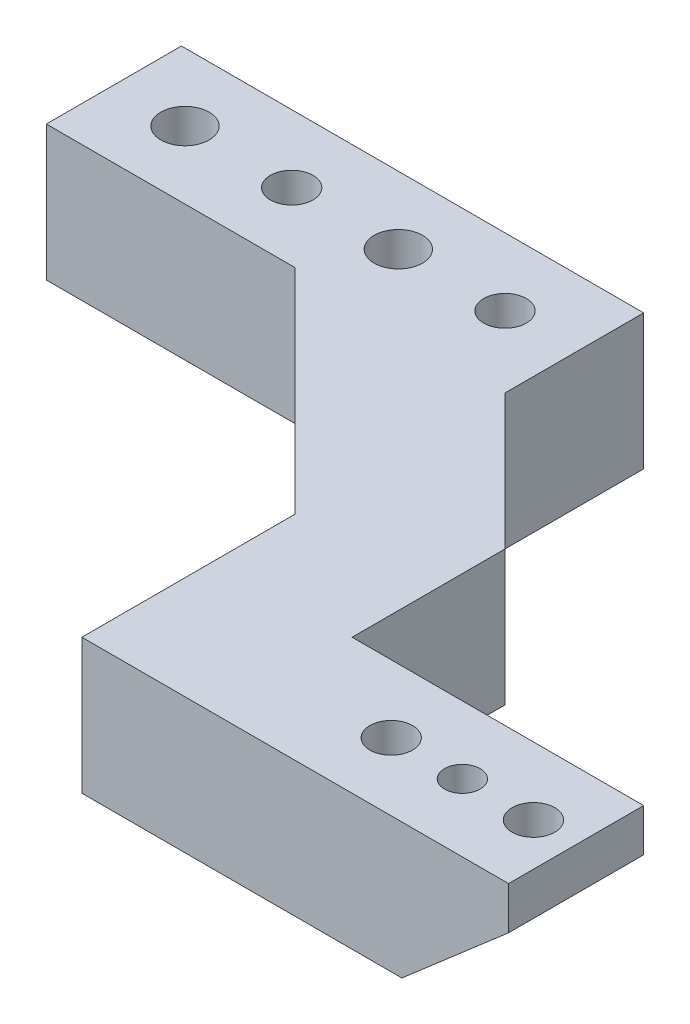
from build123d import *

# Parameters (mm, degrees)
SKETCH_1_W               = 65
SKETCH_1_H               = 19
EXTRUDE_1_DEPTH          = 19
HOLE_WIZARD_M8_2_D       = 6.8
MM_2_D                   = 6
MM_2_DEPTH               = 20
MM_2_TIP                 = 1.802581857
SKETCH_6_W               = 79
SKETCH_6_H               = 19
EXTRUDE_2_DEPTH          = 60
MM_3_D                   = 6
HOLE_WIZARD_M6_1_D       = 5
CHAMFER_2_SIZE           = 30
CUT_EXTRUDE_1_DEPTH      = 118.249733475
CUT_EXTRUDE_2_DEPTH      = 124.118845024
CUT_EXTRUDE_2_DEPTH_BACK = 124.118845024


with BuildPart() as part:
    # 草图1 → 凸台-拉伸1 (new body)
    with BuildSketch(Plane(origin=(0, 0, 0), x_dir=(1, 0, 0), z_dir=(0, 1, 0))):
        Rectangle(SKETCH_1_W, SKETCH_1_H)
    extrude(amount=EXTRUDE_1_DEPTH)

    # M8 螺纹孔2 (through all)
    with Locations(Plane(origin=(0, 19, 0), x_dir=(1, 0, 0), z_dir=(0, 1, 0))):
        with Locations((-22.5, 0), (7.5, 0)):
            Hole(HOLE_WIZARD_M8_2_D / 2)

    # 大小mm 暗销孔2
    with Locations(Plane.XZ):
        with Locations((-7.5, 0), (22.5, 0)):
            Hole(MM_2_D / 2, depth=MM_2_DEPTH)
            with Locations((0, 0, -(MM_2_DEPTH + MM_2_TIP / 2))):  # 118° drill point
                Cone(0, MM_2_D / 2, MM_2_TIP, mode=Mode.SUBTRACT)

    # 草图6 → 凸台-拉伸2 (add)
    with BuildSketch(Plane(origin=(32.5, 0, 0), x_dir=(0, 0, -1), z_dir=(1, 0, 0))):
        with Locations((-30, 9.5)):
            Rectangle(SKETCH_6_W, SKETCH_6_H)
    extrude(amount=EXTRUDE_2_DEPTH)

    # 大小mm 暗销孔3 (through all)
    with Locations(Plane(origin=(0, 19, 0), x_dir=(1, 0, 0), z_dir=(0, 1, 0))):
        with Locations((86.5, -60), (66.5, -60)):
            Hole(MM_3_D / 2)

    # M6 螺纹孔1 (through all)
    with Locations(Plane(origin=(0, 19, 0), x_dir=(1, 0, 0), z_dir=(0, 1, 0))):
        with Locations((76.5, -60)):
            Hole(HOLE_WIZARD_M6_1_D / 2)

    # 倒角2
    chamfer_2_edges = [part.edges().sort_by_distance(p)[0] for p in [
        (32.5, 9.5, 9.5),
    ]]
    chamfer(chamfer_2_edges, length=CHAMFER_2_SIZE)

    # 草图11 → 切除-拉伸1 (cut, through all)
    with BuildSketch(Plane(origin=(0, 0, 0), x_dir=(-1, 0, 0), z_dir=(0, -1, 0))):
        Polygon((-51.5, -50.5), (-95.074786325, -50.5), (-95.074786325, 28.691704374), (-32.5, 28.691704374), (-32.5, -10.02428356), (-51.5, -29.02428356), align=None)
    extrude(amount=-CUT_EXTRUDE_1_DEPTH, mode=Mode.SUBTRACT)

    # 草图12 → 切除-拉伸2 (cut, two sides: drawn at the far end of the back side and taken through both)
    with BuildSketch(Plane.XY.offset(69.5).offset(-CUT_EXTRUDE_2_DEPTH_BACK)):
        Polygon((289.998105351, 184.165024638), (92.5, 13), (77.5, 0), (-119.998105351, -171.165024638), (222.331943924, -566.16123534), (632.328154627, -210.831186065), align=None)
    extrude(amount=CUT_EXTRUDE_2_DEPTH + CUT_EXTRUDE_2_DEPTH_BACK, mode=Mode.SUBTRACT)


solid = part.part
